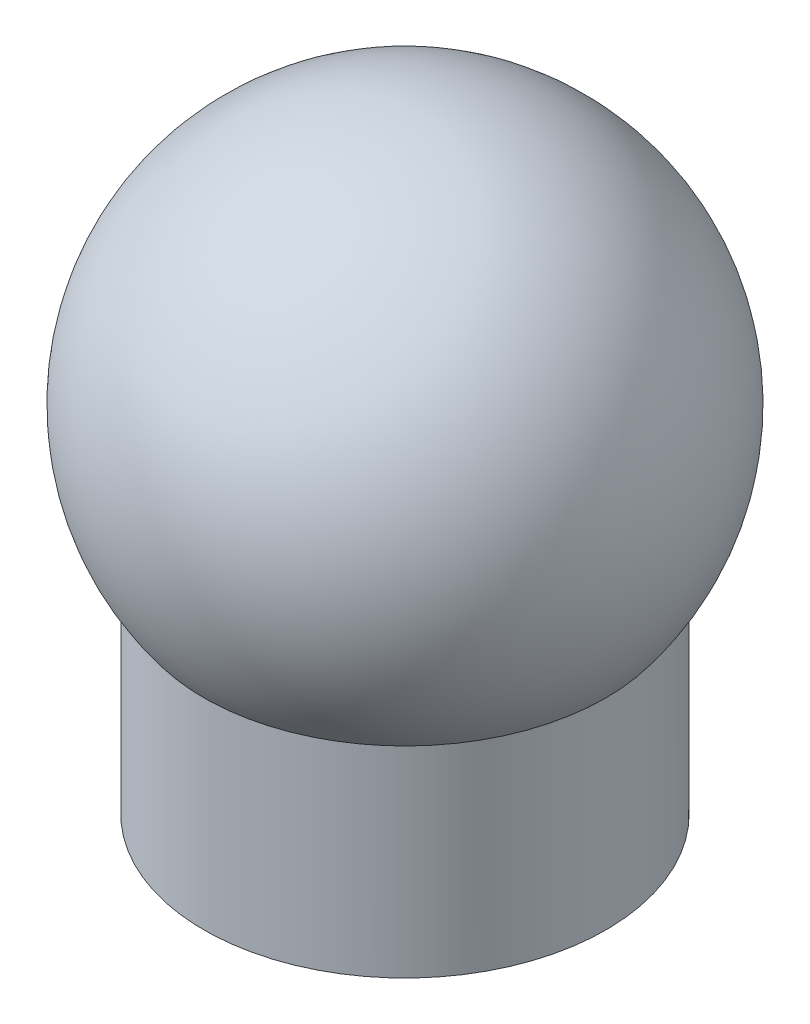
from build123d import *


with BuildPart() as part:
    # Sketch1 → Base-Revolve (revolve)
    with BuildSketch(Plane.XY, mode=Mode.PRIVATE) as base_revolve_sk:
        with BuildLine():
            Line((0, 0), (5, 0))
            Line((5, 0), (5, 5))
            ThreePointArc((5, 5), (5.649617135, 11.62055311), (0, 15.132753579))
            Line((0, 15.132753579), (0, 0))
        make_face()
    revolve(base_revolve_sk.sketch.rotate(Axis((0, 0, 0), (0, 1, 0)), 90), axis=Axis((0, 0, 0), (0, 1, 0)))


solid = part.part
